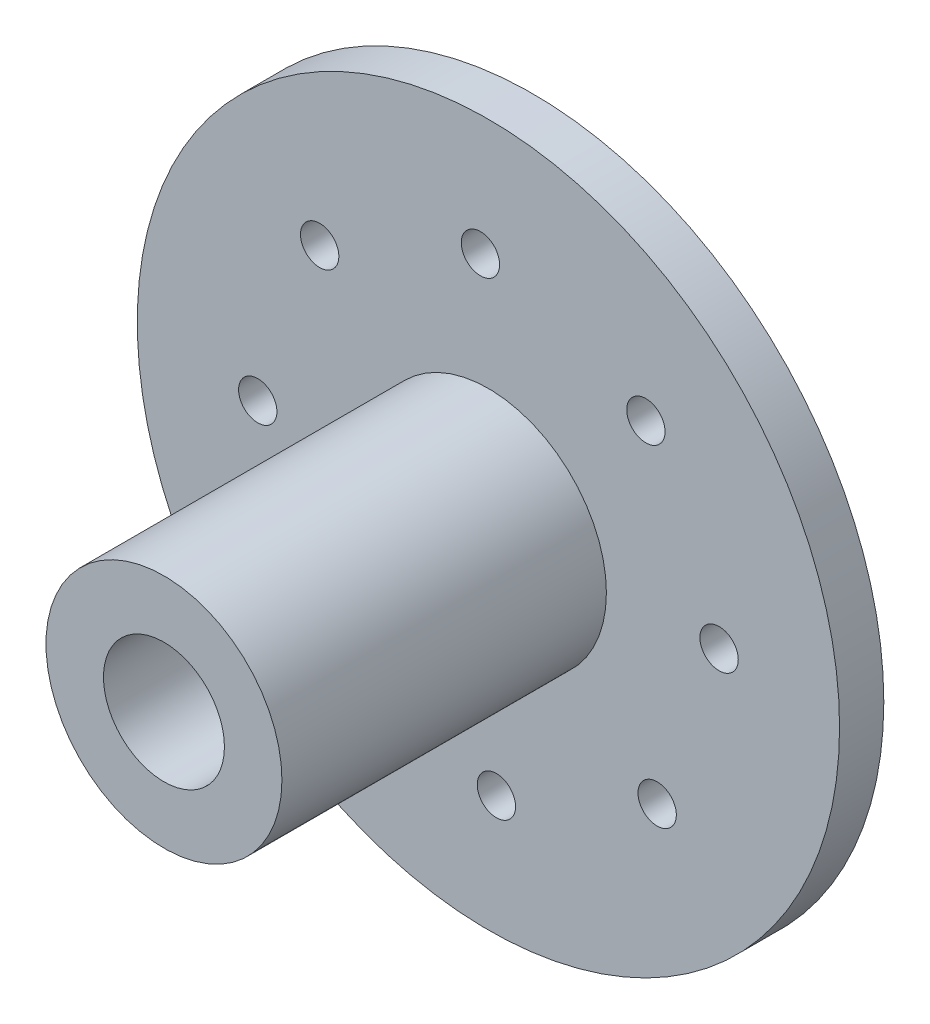
from build123d import *

# Parameters (mm, degrees)
ESQUISSE1_R             = 23.81
BOSS_EXTRU_1_DEPTH      = 3
ESQUISSE2_R             = 8
BOSS_EXTRU_2_DEPTH      = 22
ESQUISSE3_R             = 1.3
ENL_V_MAT_EXTRU_1_DEPTH = 24
ESQUISSE4_R             = 4.1
ENL_V_MAT_EXTRU_2_DEPTH = 18.5
ESQUISSE5_R             = 0.4
ENL_V_MAT_EXTRU_3_DEPTH = 10
ENL_V_START             = -1
ESQUISSE6_R             = 4.1
ENL_V_MAT_EXTRU_4_DEPTH = 1


with BuildPart() as part:
    # Esquisse1 → Boss.-Extru.1 (new body)
    with BuildSketch(Plane.XY):
        Circle(ESQUISSE1_R)
    extrude(amount=BOSS_EXTRU_1_DEPTH)

    # Esquisse2 → Boss.-Extru.2 (add)
    with BuildSketch(Plane.XY.offset(3)):
        Circle(ESQUISSE2_R)
    extrude(amount=BOSS_EXTRU_2_DEPTH)

    # Esquisse3 → Enlèv. mat.-Extru.1 (cut)
    with BuildSketch(Plane.XY.offset(3)):
        with Locations((-11.442120986, 10.677095455)):
            Circle(ESQUISSE3_R)
        with Locations((-0.540954741, 15.64064794)):
            Circle(ESQUISSE3_R)
        with Locations((10.677095455, 11.442120986)):
            Circle(ESQUISSE3_R)
        with Locations((15.64064794, 0.540954741)):
            Circle(ESQUISSE3_R)
        with Locations((11.442120986, -10.677095455)):
            Circle(ESQUISSE3_R)
        with Locations((0.540954741, -15.64064794)):
            Circle(ESQUISSE3_R)
        with Locations((-10.677095455, -11.442120986)):
            Circle(ESQUISSE3_R)
        with Locations((-15.64064794, -0.540954741)):
            Circle(ESQUISSE3_R)
    extrude(amount=-ENL_V_MAT_EXTRU_1_DEPTH, mode=Mode.SUBTRACT)

    # Esquisse4 → Enlèv. mat.-Extru.2 (cut)
    with BuildSketch(Plane.XY.offset(25)):
        Circle(ESQUISSE4_R)
    extrude(amount=-ENL_V_MAT_EXTRU_2_DEPTH, mode=Mode.SUBTRACT)

    # Esquisse5 → Enlèv. mat.-Extru.3 (cut)
    with BuildSketch(Plane(origin=(0, 0, 0), x_dir=(-1, 0, 0), z_dir=(0, 0, -1))):
        Circle(ESQUISSE5_R)
    extrude(amount=-ENL_V_MAT_EXTRU_3_DEPTH, mode=Mode.SUBTRACT)

    # Esquisse6 → Enlèv. mat.-Extru.4 (cut)
    with BuildSketch(Plane(origin=(0, 0, 0), x_dir=(-1, 0, 0), z_dir=(0, 0, -1)).offset(ENL_V_START)):
        with Locations(Location((0, 0, 0), (0, 0, 180))):
            Circle(ESQUISSE6_R)
    extrude(amount=ENL_V_MAT_EXTRU_4_DEPTH, mode=Mode.SUBTRACT)


solid = part.part
